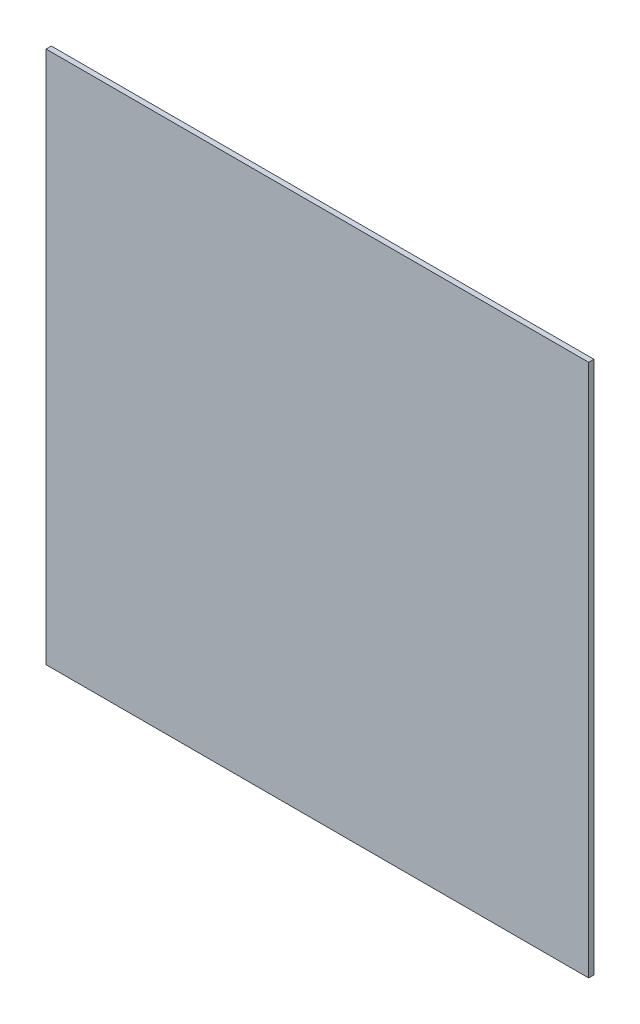
from build123d import *

# Parameters (mm, degrees)
SKETCH_1_W      = 103.8
SKETCH_1_H      = 102
EXTRUDE_1_DEPTH = 1


with BuildPart() as part:
    # 草图1 → 凸台-拉伸1 (new body)
    with BuildSketch(Plane.XY):
        with Locations((10.872014971, 13.778910729)):
            Rectangle(SKETCH_1_W, SKETCH_1_H)
    extrude(amount=EXTRUDE_1_DEPTH)


solid = part.part
